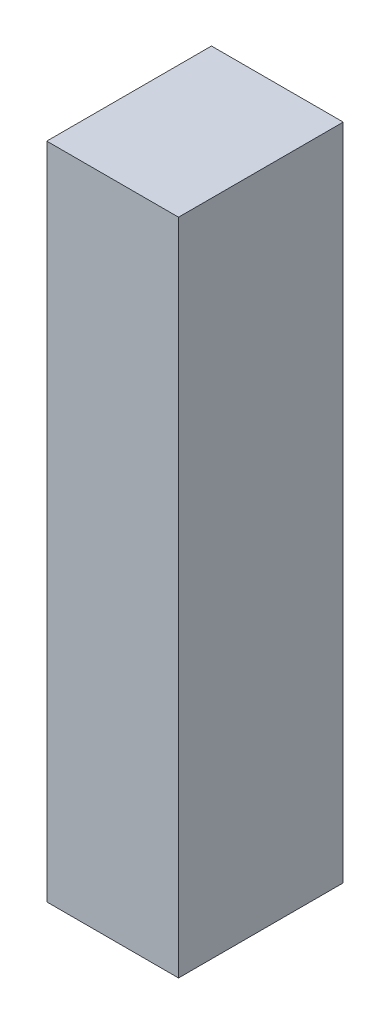
from build123d import *

# Parameters (mm, degrees)
BOSS_EXTRUDE1_DEPTH      = 10
BOSS_EXTRUDE1_DEPTH_BACK = 50
SKETCH1_W                = 12
SKETCH1_H                = 15
F_25_SCALE_SCALE         = 0.25


with BuildPart() as part:
    # Sketch1 → Boss-Extrude1 (new, two sides: drawn at the far end of the back side and taken through both)
    with BuildSketch(Plane(origin=(0, 0, 0), x_dir=(1, 0, 0), z_dir=(0, 1, 0)).offset(-BOSS_EXTRUDE1_DEPTH_BACK)):
        Rectangle(SKETCH1_W, SKETCH1_H)
    extrude(amount=BOSS_EXTRUDE1_DEPTH + BOSS_EXTRUDE1_DEPTH_BACK)


with BuildPart() as part_1:
    # 25% Scale: scaled about (0, -20, 0)
    add(part.part.scale(F_25_SCALE_SCALE).moved(Location((0, -15, 0))))


solid = part_1.part
